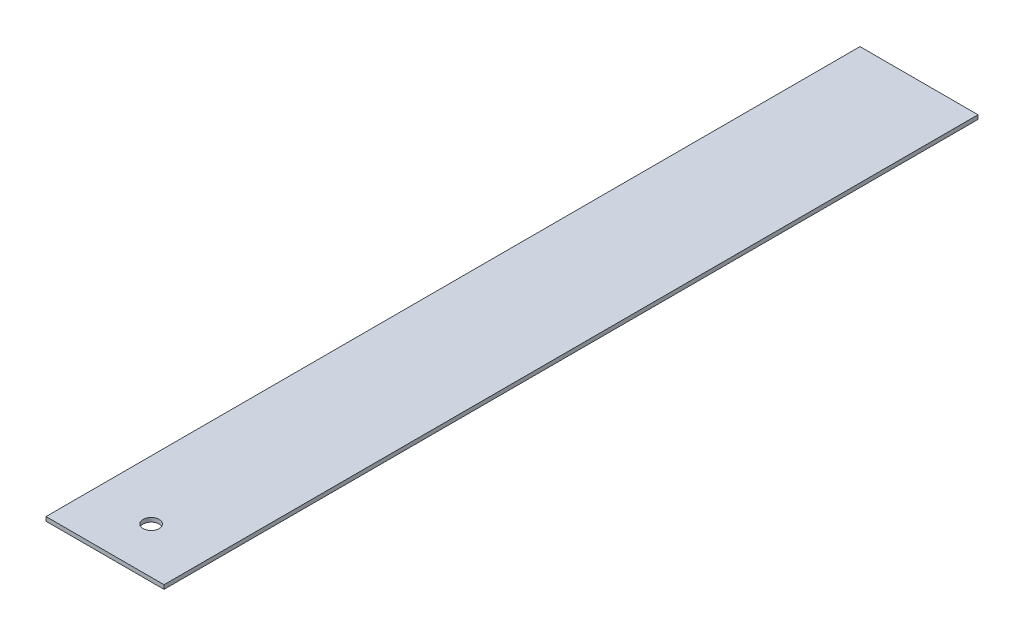
from build123d import *

# Parameters (mm, degrees)
SKETCH1_W           = 22.098
SKETCH1_H           = 152.4
BOSS_EXTRUDE1_DEPTH = 0.762
CUT_EXTRUDE1_REACH  = 155.996
SKETCH2_R           = 1.5


with BuildPart() as part:
    # Sketch1 → Boss-Extrude1 (new body)
    with BuildSketch(Plane(origin=(0, 0, 0), x_dir=(1, 0, 0), z_dir=(0, 1, 0))):
        with Locations((11.049, 76.2)):
            Rectangle(SKETCH1_W, SKETCH1_H)
    extrude(amount=BOSS_EXTRUDE1_DEPTH)

    # Sketch2 → Cut-Extrude1 (cut, up to next)
    with BuildSketch(Plane(origin=(0, 0.762, 0), x_dir=(1, 0, 0), z_dir=(0, 1, 0)), mode=Mode.PRIVATE) as cut_extrude1_sk1:
        with Locations(Location((11.049, 8.636, 0), (0, 0, 270))):
            Circle(SKETCH2_R)
    cut_extrude1_tool1 = extrude(cut_extrude1_sk1.sketch, amount=-CUT_EXTRUDE1_REACH, mode=Mode.PRIVATE) & part.part
    add(cut_extrude1_tool1.solids().sort_by_distance((11.049, 0.762, -8.636))[0], mode=Mode.SUBTRACT)


solid = part.part
